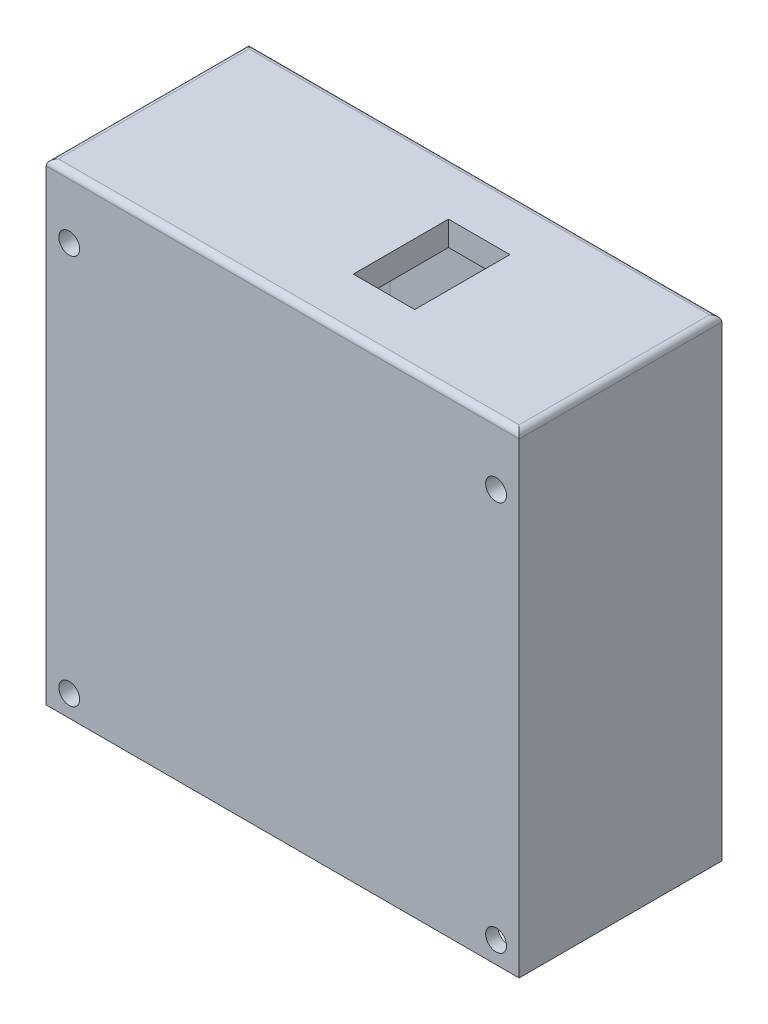
from build123d import *

# Parameters (mm, degrees)
SKETCH_1_W          = 77
SKETCH_1_H          = 33
EXTRUDE_1_DEPTH     = 77
CUT_EXTRUDE_1_DEPTH = 73
SKETCH_3_R          = 1.7
CUT_EXTRUDE_2_DEPTH = 93.196800378
CUT_EXTRUDE_3_REACH = 112.137
SKETCH_5_W          = 10
SKETCH_5_H          = 15.5
CUT_EXTRUDE_4_DEPTH = 85.163531427
SKETCH_6_W          = 15.75
SKETCH_6_H          = 28
CUT_EXTRUDE_5_DEPTH = 59.5
FILLET_1_R          = 1


with BuildPart() as part:
    # ｽｹｯﾁ1 → ﾎﾞｽ - 押し出し1 (new body)
    with BuildSketch(Plane(origin=(0, 0, 0), x_dir=(1, 0, 0), z_dir=(0, 1, 0))):
        Rectangle(SKETCH_1_W, SKETCH_1_H)
    extrude(amount=EXTRUDE_1_DEPTH)

    # ｽｹｯﾁ2 → ｶｯﾄ - 押し出し1 (cut)
    with BuildSketch(Plane.XZ):
        with BuildLine():
            Line((12.75, 13.75), (-12.75, 13.75))
            ThreePointArc((-12.75, 13.75), (-16.992640687, 11.992640687), (-18.75, 7.75))
            Line((-18.75, 7.75), (-18.75, -7.75))
            ThreePointArc((-18.75, -7.75), (-16.992640687, -11.992640687), (-12.75, -13.75))
            Line((-12.75, -13.75), (12.75, -13.75))
            ThreePointArc((12.75, -13.75), (16.992640687, -11.992640687), (18.75, -7.75))
            Line((18.75, -7.75), (18.75, 7.75))
            ThreePointArc((18.75, 7.75), (16.992640687, 11.992640687), (12.75, 13.75))
        make_face()
    extrude(amount=-CUT_EXTRUDE_1_DEPTH, mode=Mode.SUBTRACT)

    # ｽｹｯﾁ3 → ｶｯﾄ - 押し出し2 (cut, through all)
    with BuildSketch(Plane.XY.offset(16.5)):
        with Locations((34.75, 3.5)):
            Circle(SKETCH_3_R)
        with Locations((34.75, 67)):
            Circle(SKETCH_3_R)
        with Locations((-34.75, 67)):
            Circle(SKETCH_3_R)
        with Locations((-34.75, 3.5)):
            Circle(SKETCH_3_R)
    extrude(amount=-CUT_EXTRUDE_2_DEPTH, mode=Mode.SUBTRACT)

    # ｽｹｯﾁ4 → ｶｯﾄ - 押し出し3 (cut, up to next)
    with BuildSketch(Plane.ZY.offset(38.5), mode=Mode.PRIVATE) as cut_extrude_3_sk1:
        with BuildLine():
            Line((6.5, 40), (-6.5, 40))
            ThreePointArc((-6.5, 40), (-10.742640687, 38.242640687), (-12.5, 34))
            Line((-12.5, 34), (-12.5, 0))
            Line((-12.5, 0), (12.5, 0))
            Line((12.5, 0), (12.5, 34))
            ThreePointArc((12.5, 34), (10.742640687, 38.242640687), (6.5, 40))
        make_face()
    cut_extrude_3_tool1 = extrude(cut_extrude_3_sk1.sketch, amount=-CUT_EXTRUDE_3_REACH, mode=Mode.PRIVATE) & part.part
    add(cut_extrude_3_tool1.solids().sort_by_distance((-38.5, 19.707157, 0))[0], mode=Mode.SUBTRACT)

    # ｽｹｯﾁ5 → ｶｯﾄ - 押し出し4 (cut, through all)
    with BuildSketch(Plane.XZ.offset(-73)):
        with Locations((7.75, 0)):
            Rectangle(SKETCH_5_W, SKETCH_5_H)
    extrude(amount=-CUT_EXTRUDE_4_DEPTH, mode=Mode.SUBTRACT)

    # ｽｹｯﾁ6 → ｶｯﾄ - 押し出し5 (cut)
    with BuildSketch(Plane(origin=(0, 0, 0), x_dir=(-1, 0, 0), z_dir=(0, -1, 0))):
        with Locations((-28.625, -0.5)):
            Rectangle(SKETCH_6_W, SKETCH_6_H)
    extrude(amount=-CUT_EXTRUDE_5_DEPTH, mode=Mode.SUBTRACT)

    # ﾌｨﾚｯﾄ1
    fillet_1_edges = [part.edges().sort_by_distance(p)[0] for p in [
        (38.5, 77, 0),
        (0, 77, -16.5),
        (-38.5, 77, 0),
        (0, 77, 16.5),
    ]]
    fillet(fillet_1_edges, radius=FILLET_1_R)


solid = part.part
